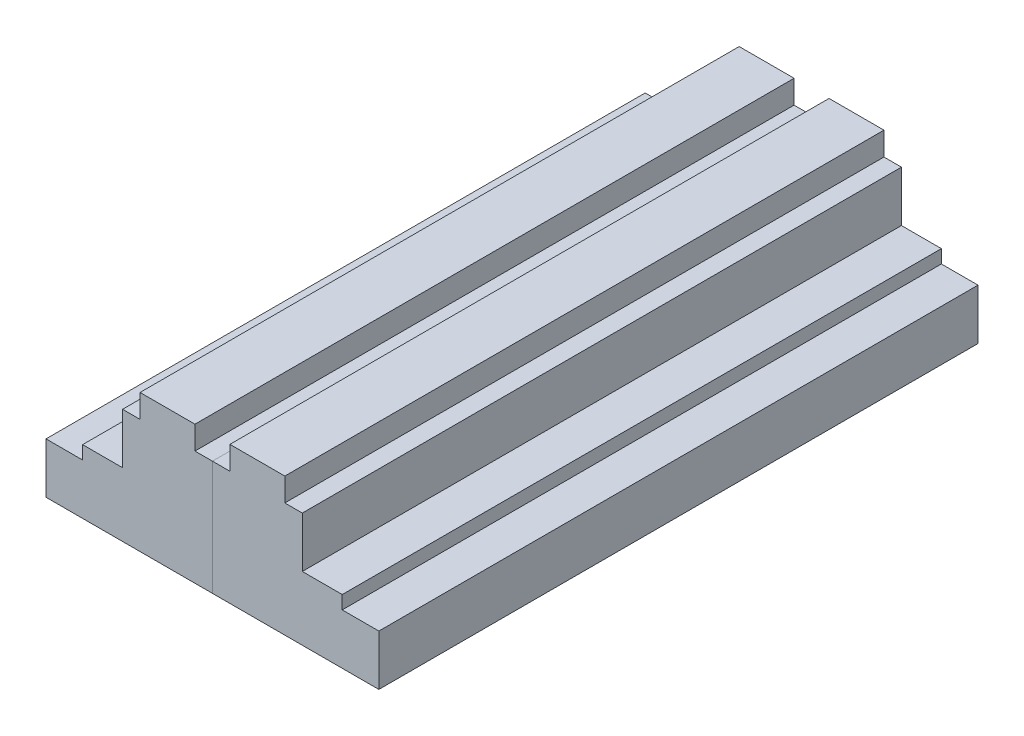
from build123d import *

# Parameters (mm, degrees)
BOSS_EXTRUDE1_DEPTH = 90


with BuildPart() as part:
    # Sketch1 → Boss-Extrude1 (new body)
    with BuildSketch(Plane.XY):
        Polygon((-25, 0), (-25, 7.6), (-19.5, 7.6), (-19.5, 9.6), (-13.5, 9.6), (-13.5, 17.2), (-10.875, 17.2), (-10.875, 20.7), (-2.625, 20.7), (-2.625, 17.2), (0, 17.2), (0, 0), align=None)
    extrude(amount=BOSS_EXTRUDE1_DEPTH)


with BuildPart() as body_2:
    # Mirror1: mirrored copy
    add(part.part.mirror(Plane(origin=(0, 17.2, 90), x_dir=(0, 0, 1), z_dir=(1, 0, 0))))


solid = Compound([part.part, body_2.part])
